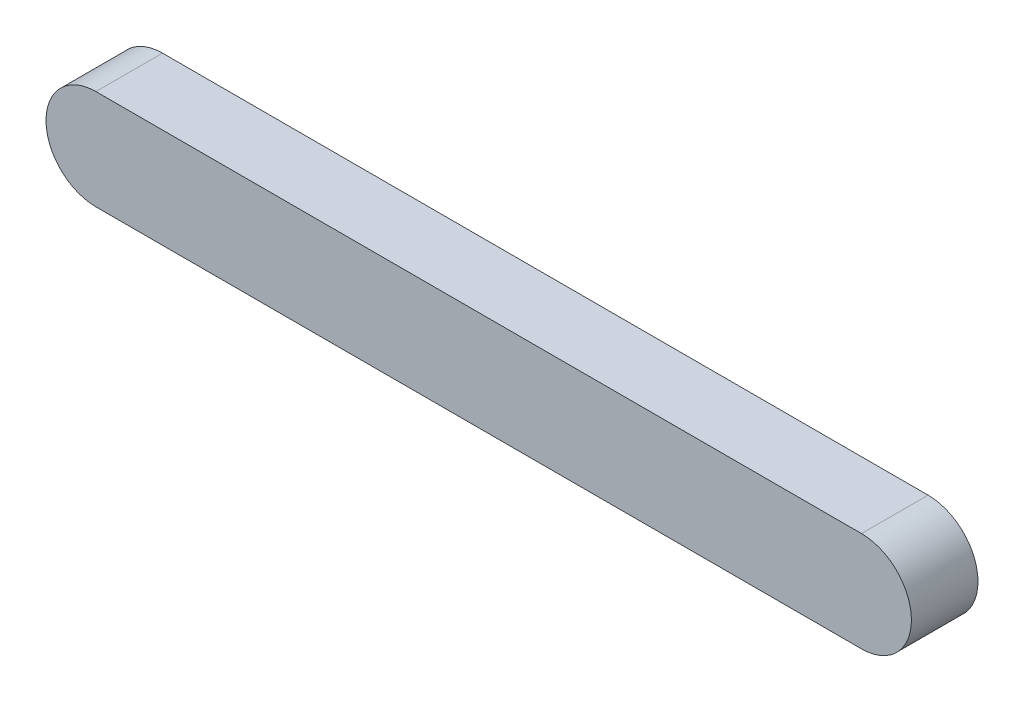
from build123d import *

# Parameters (mm, degrees)
EXTRUDE_1_DEPTH = 10


with BuildPart() as part:
    # 草图1 → 凸台-拉伸1 (new body)
    with BuildSketch(Plane.XY):
        with BuildLine():
            Line((115, -7.5), (0, -7.5))
            ThreePointArc((0, -7.5), (-7.5, 0), (0, 7.5))
            Line((0, 7.5), (115, 7.5))
            ThreePointArc((115, 7.5), (122.5, 0), (115, -7.5))
        make_face()
    extrude(amount=EXTRUDE_1_DEPTH)


solid = part.part
